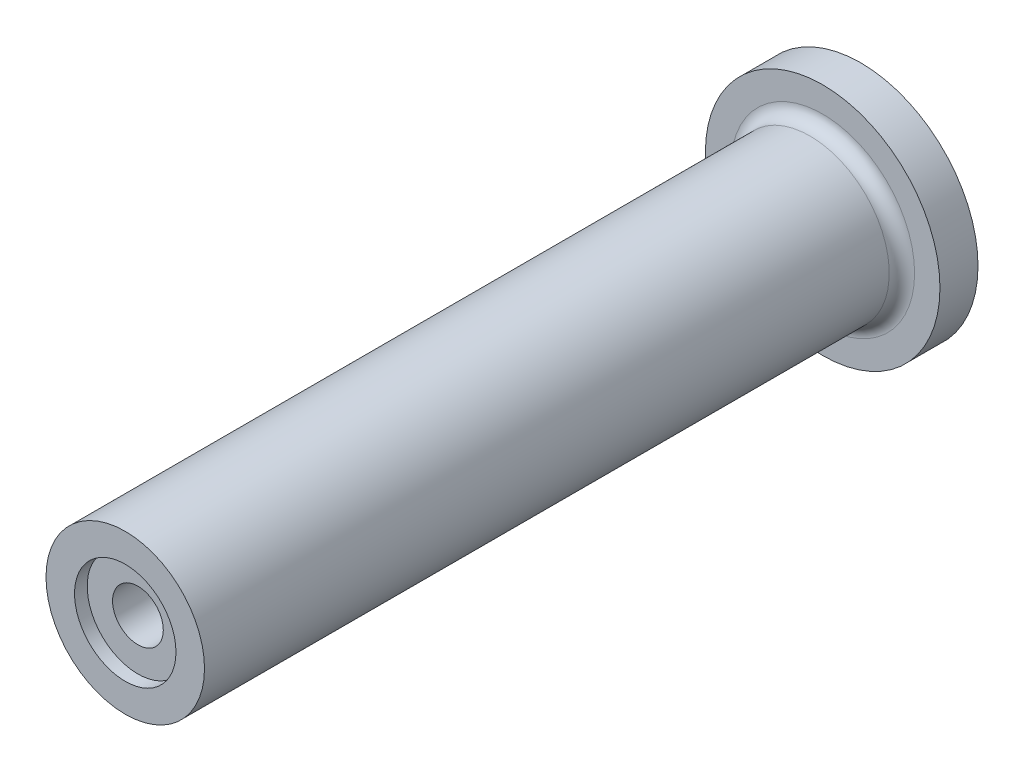
from build123d import *

# Parameters (mm, degrees)
SKETCH_2_R          = 12.5
SKETCH_2_R_2        = 4
EXTRUDE_1_DEPTH     = 55
SKETCH_3_R          = 8
CUT_EXTRUDE_1_DEPTH = 2
EXTRUDE_START       = 6
SKETCH_5_R          = 18.5
SKETCH_5_R_2        = 4
EXTRUDE_2_DEPTH     = 6
FILLET_1_R          = 2


with BuildPart() as part:
    # 草图2 → 凸台-拉伸1 (new, symmetric)
    with BuildSketch(Plane.XY):
        Circle(SKETCH_2_R)
        Circle(SKETCH_2_R_2, mode=Mode.SUBTRACT)
    extrude(amount=EXTRUDE_1_DEPTH, both=True)

    # 草图3 → 切除-拉伸1 (cut)
    with BuildSketch(Plane.XY.offset(55)):
        Circle(SKETCH_3_R)
    extrude(amount=-CUT_EXTRUDE_1_DEPTH, mode=Mode.SUBTRACT)

    # 草图5 → 凸台-拉伸2 (add)
    with BuildSketch(Plane(origin=(0, 0, -55), x_dir=(-1, 0, 0), z_dir=(0, 0, -1)).offset(EXTRUDE_START)):
        Circle(SKETCH_5_R)
        Circle(SKETCH_5_R_2, mode=Mode.SUBTRACT)
    extrude(amount=-EXTRUDE_2_DEPTH)

    # 圆角1
    fillet_1_edges = [part.edges().sort_by_distance(p)[0] for p in [
        (-12.5, 0, -55),
    ]]
    fillet(fillet_1_edges, radius=FILLET_1_R)


solid = part.part
